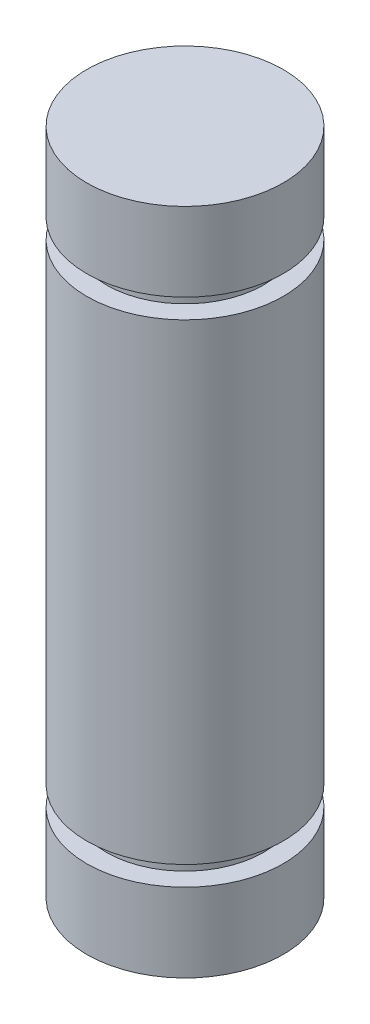
from build123d import *

# Parameters (mm, degrees)
SKETCH1_R           = 6.35
BOSS_EXTRUDE2_DEPTH = 30.48
SKETCH4_R           = 5.08
BOSS_EXTRUDE3_DEPTH = 1.27
SKETCH5_R           = 6.35
BOSS_EXTRUDE4_DEPTH = 5.08
BOSS_EXTRUDE5_START = 1.27
SKETCH6_R           = 5.08
BOSS_EXTRUDE5_DEPTH = 1.27
BOSS_EXTRUDE6_START = 5.08
SKETCH7_R           = 6.35
BOSS_EXTRUDE6_DEPTH = 5.08


with BuildPart() as part:
    # Sketch1 → Boss-Extrude2 (new body)
    with BuildSketch(Plane(origin=(0, 0, 0), x_dir=(1, 0, 0), z_dir=(0, 1, 0))):
        with Locations(Location((0, 0, 0), (0, 0, 90))):
            Circle(SKETCH1_R)
    extrude(amount=BOSS_EXTRUDE2_DEPTH)

    # Sketch4 → Boss-Extrude3 (add)
    with BuildSketch(Plane(origin=(0, 30.48, 0), x_dir=(1, 0, 0), z_dir=(0, 1, 0))):
        with Locations(Location((0, 0, 0), (0, 0, 270))):
            Circle(SKETCH4_R)
    extrude(amount=BOSS_EXTRUDE3_DEPTH)

    # Sketch5 → Boss-Extrude4 (add)
    with BuildSketch(Plane(origin=(0, 31.75, 0), x_dir=(1, 0, 0), z_dir=(0, 1, 0))):
        with Locations(Location((0, 0, 0), (0, 0, 90))):
            Circle(SKETCH5_R)
    extrude(amount=BOSS_EXTRUDE4_DEPTH)

    # Sketch6 → Boss-Extrude5 (add)
    with BuildSketch(Plane.XZ.offset(BOSS_EXTRUDE5_START)):
        with Locations(Location((0, 0, 0), (0, 0, 90))):
            Circle(SKETCH6_R)
    extrude(amount=-BOSS_EXTRUDE5_DEPTH)

    # Sketch7 → Boss-Extrude6 (add)
    with BuildSketch(Plane.XZ.offset(1.27).offset(BOSS_EXTRUDE6_START)):
        with Locations(Location((0, 0, 0), (0, 0, 270))):
            Circle(SKETCH7_R)
    extrude(amount=-BOSS_EXTRUDE6_DEPTH)


solid = part.part
